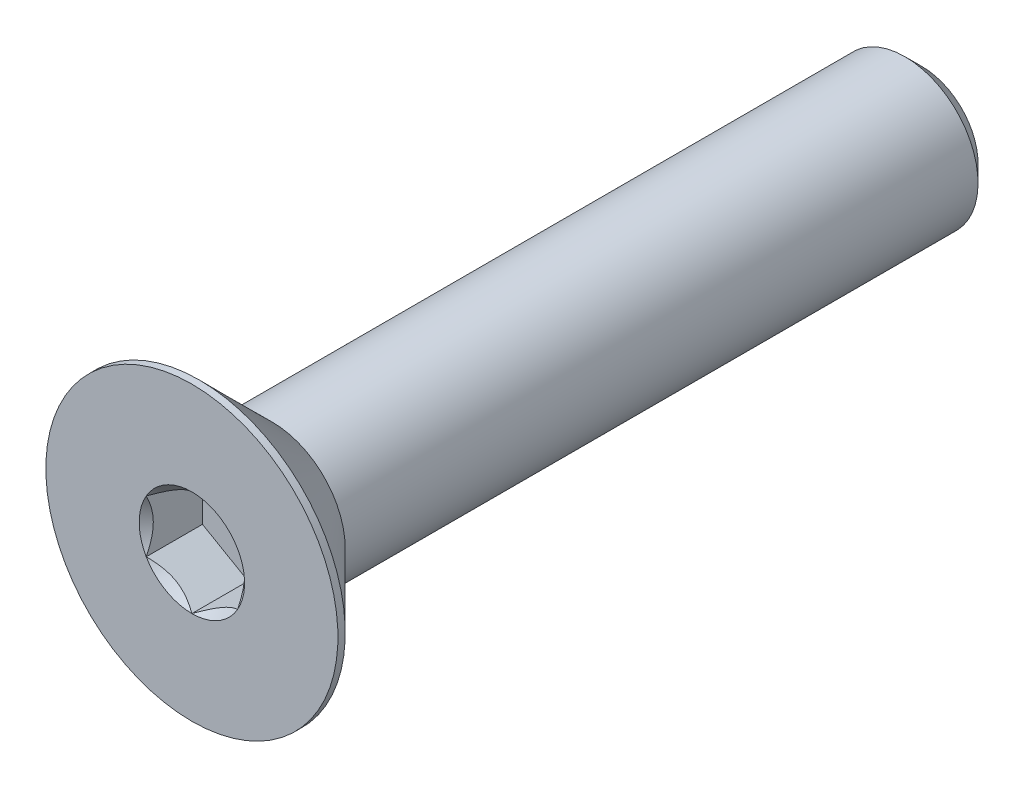
from build123d import *

# Parameters (mm, degrees)
SKETCH1_W          = 40
SKETCH1_H          = 4
CHAMFER1_SIZE      = 0.9375
CUT_EXTRUDE2_DEPTH = 3.08


with BuildPart() as part:
    # Sketch1 → Revolve1 (revolve)
    with BuildSketch(Plane(origin=(0, 0, 0), x_dir=(0, 0, -1), z_dir=(1, 0, 0))):
        with Locations((20, 2)):
            Rectangle(SKETCH1_W, SKETCH1_H)
    revolve(axis=Axis((0, 0, -40), (0, 0, 1)))

    # Chamfer1
    chamfer1_edges = [part.edges().sort_by_distance(p)[0] for p in [
        (0, -4, -40),
    ]]
    chamfer(chamfer1_edges, length=CHAMFER1_SIZE)

    # Sketch7 → Revolve2 (revolve)
    with BuildSketch(Plane(origin=(0, 0, 0), x_dir=(0, 0, -1), z_dir=(1, 0, 0)), mode=Mode.PRIVATE) as revolve2_sk:
        Polygon((0, 8), (0.4, 8), (4.4, 4), (4.4, 0), (0, 0), align=None)
    revolve(revolve2_sk.sketch.rotate(Axis((0, 0, 0), (0, 0, -1)), 180), axis=Axis((0, 0, 0), (0, 0, -1)))

    # Boss-Extrude1 cone 1 section (through the dimple's axis) → Boss-Extrude1 (revolve)
    with BuildSketch(Plane(origin=(0, 0, -4.4), x_dir=(0, -1, 0), z_dir=(1, 0, 0))):
        Polygon((0, 0), (4, 0), (0, 4), align=None)
    revolve(axis=Axis((0, 0, -4.4), (0, 0, -1)))

    # Sketch5 → Cut-Extrude2 (cut)
    with BuildSketch(Plane.XY):
        Polygon((2.5, -1.443375673), (2.5, 1.443375673), (0, 2.886751346), (-2.5, 1.443375673), (-2.5, -1.443375673), (0, -2.886751346), align=None)
    extrude(amount=-CUT_EXTRUDE2_DEPTH, mode=Mode.SUBTRACT)

    # Cut-Extrude3 cone 1 section (through the dimple's axis) → Cut-Extrude3 (revolve, cut)
    with BuildSketch(Plane(origin=(0, 0, 0), x_dir=(0, -1, 0), z_dir=(1, 0, 0))):
        Polygon((0, 0), (2.886751346, 0), (0, 2.886751346), align=None)
    revolve(axis=Axis((0, 0, 0), (0, 0, -1)), mode=Mode.SUBTRACT)


solid = part.part
